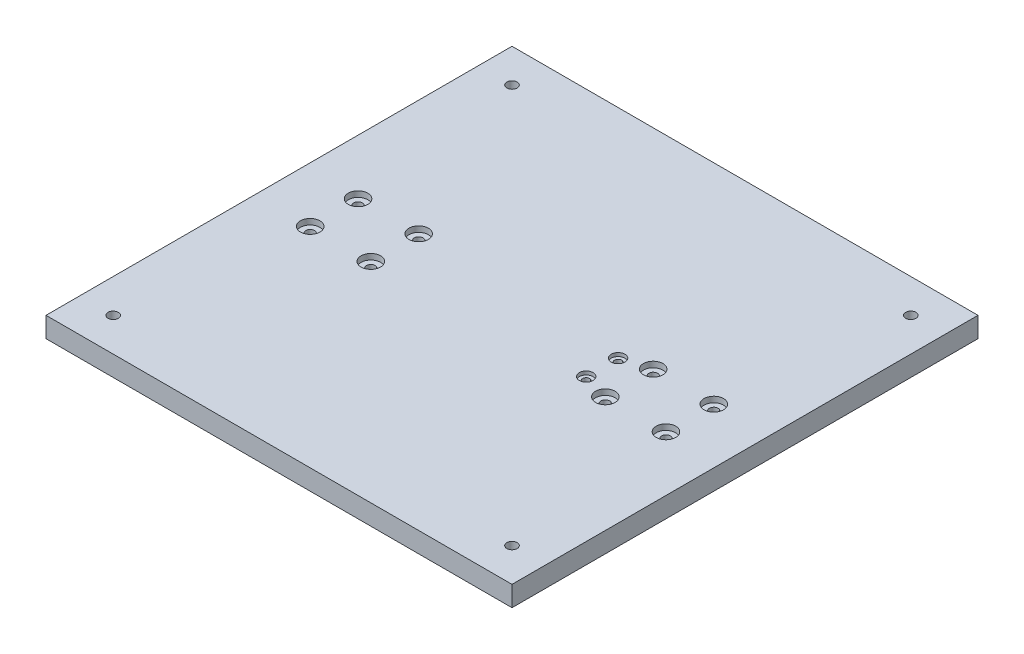
from build123d import *

# Parameters (mm, degrees)
SKETCH2_W                               = 292.1
SKETCH2_H                               = 292.1
BOSS_EXTRUDE1_DEPTH                     = 12.7
F_6_5_6_5_DIAMETER_HOLE1_D              = 6.5
CBORE_FOR_M5_HEX_HEAD_BOLT1_D           = 5.5
CBORE_FOR_M5_HEX_HEAD_BOLT1_CBORE_D     = 12.24
CBORE_FOR_M5_HEX_HEAD_BOLT1_CBORE_DEPTH = 3.58
CBORE_FOR_M4_SBHCS1_D                   = 4.5
CBORE_FOR_M4_SBHCS1_CBORE_D             = 8.6
CBORE_FOR_M4_SBHCS1_CBORE_DEPTH         = 2.2


with BuildPart() as part:
    # Sketch2 → Boss-Extrude1 (new body)
    with BuildSketch(Plane(origin=(0, 0, 0), x_dir=(1, 0, 0), z_dir=(0, 1, 0))):
        Rectangle(SKETCH2_W, SKETCH2_H)
    extrude(amount=BOSS_EXTRUDE1_DEPTH)

    # Ø6.5 (6.5) Diameter Hole1 (through all)
    with Locations(Plane(origin=(0, 12.7, 0), x_dir=(1, 0, 0), z_dir=(0, 1, 0))):
        with Locations((-125, 125), (125, 125), (125, -125), (-125, -125)):
            Hole(F_6_5_6_5_DIAMETER_HOLE1_D / 2)

    # CBORE for M5 Hex Head Bolt1 (through all)
    with Locations(Plane(origin=(0, 12.7, 0), x_dir=(1, 0, 0), z_dir=(0, 1, 0))):
        with Locations((-73.5, -15), (-111.5, 15), (-111.5, -15), (-73.5, 15)):
            cbore_for_m5_hex_head_bolt1 = CounterBoreHole(CBORE_FOR_M5_HEX_HEAD_BOLT1_D / 2, CBORE_FOR_M5_HEX_HEAD_BOLT1_CBORE_D / 2, CBORE_FOR_M5_HEX_HEAD_BOLT1_CBORE_DEPTH)

    # Mirror1: CBORE for M5 Hex Head Bolt1 across plane
    add(cbore_for_m5_hex_head_bolt1.mirror(Plane(origin=(0, 0, 0), x_dir=(0, 0, 1), z_dir=(1, 0, 0))), mode=Mode.SUBTRACT)

    # CBORE for M4 SBHCS1 (through all)
    with Locations(Plane(origin=(0, 12.7, 0), x_dir=(1, 0, 0), z_dir=(0, 1, 0))):
        with Locations((56.500001429, 10), (56.500001429, -10.0000005)):
            CounterBoreHole(CBORE_FOR_M4_SBHCS1_D / 2, CBORE_FOR_M4_SBHCS1_CBORE_D / 2, CBORE_FOR_M4_SBHCS1_CBORE_DEPTH)


solid = part.part
